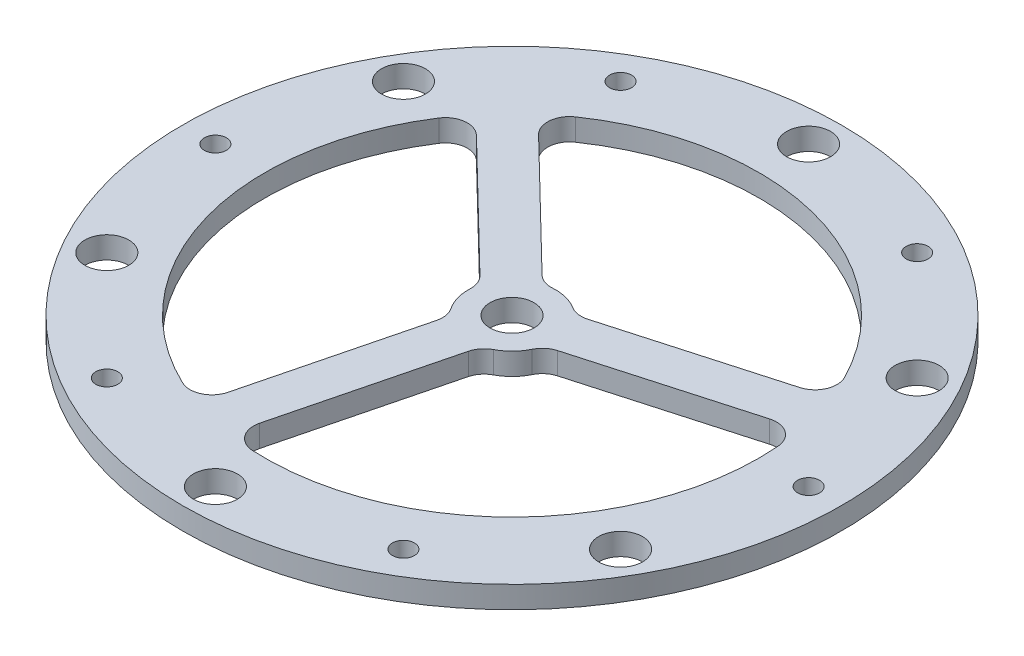
from build123d import *

# Parameters (mm, degrees)
SKETCH1_R                = 30
SKETCH1_R_2              = 2
BOSS_EXTRUDE1_DEPTH      = 2
SKETCH3_R                = 1
CUT_EXTRUDE1_DEPTH       = 3
SKETCH4_R                = 2
CUT_EXTRUDE2_DEPTH       = 10
FILLET1_R                = 2
CIRPATTERN1_COUNT        = 3
FILLET1_OF_CIRPATTERN1_R = 2


with BuildPart() as part:
    # Sketch1 → Boss-Extrude1 (new body)
    with BuildSketch(Plane(origin=(0, 0, 0), x_dir=(1, 0, 0), z_dir=(0, 1, 0))):
        with Locations(Location((0, 0, 0), (0, 0, 270))):
            Circle(SKETCH1_R)
        with Locations(Location((0, 27, 0), (0, 0, 270))):
            Circle(SKETCH1_R_2, mode=Mode.SUBTRACT)
        with Locations(Location((23.382685902, 13.5, 0), (0, 0, 270))):
            Circle(SKETCH1_R_2, mode=Mode.SUBTRACT)
        with Locations(Location((23.382685902, -13.5, 0), (0, 0, 270))):
            Circle(SKETCH1_R_2, mode=Mode.SUBTRACT)
        with Locations(Location((0, -27, 0), (0, 0, 270))):
            Circle(SKETCH1_R_2, mode=Mode.SUBTRACT)
        with Locations(Location((-23.382685902, -13.5, 0), (0, 0, 270))):
            Circle(SKETCH1_R_2, mode=Mode.SUBTRACT)
        with Locations(Location((-23.382685902, 13.5, 0), (0, 0, 270))):
            Circle(SKETCH1_R_2, mode=Mode.SUBTRACT)
    extrude(amount=BOSS_EXTRUDE1_DEPTH)

    # Sketch3 → Cut-Extrude1 (cut)
    with BuildSketch(Plane(origin=(0, 2, 0), x_dir=(1, 0, 0), z_dir=(0, 1, 0))):
        with Locations(Location((-13.5, 23.382685902, 0), (0, 0, 270))):
            Circle(SKETCH3_R)
        with Locations(Location((13.5, 23.382685902, 0), (0, 0, 270))):
            Circle(SKETCH3_R)
        with Locations(Location((27, 0, 0), (0, 0, 270))):
            Circle(SKETCH3_R)
        with Locations(Location((13.5, -23.382685902, 0), (0, 0, 270))):
            Circle(SKETCH3_R)
        with Locations(Location((-13.5, -23.382685902, 0), (0, 0, 270))):
            Circle(SKETCH3_R)
        with Locations(Location((-27, 0, 0), (0, 0, 270))):
            Circle(SKETCH3_R)
    extrude(amount=-CUT_EXTRUDE1_DEPTH, mode=Mode.SUBTRACT)

    # Sketch4 → Cut-Extrude2 (cut)
    with BuildSketch(Plane(origin=(0, 2, 0), x_dir=(1, 0, 0), z_dir=(0, 1, 0))):
        with Locations(Location((0, 0, 0), (0, 0, 270))):
            Circle(SKETCH4_R)
        with BuildLine():
            Line((-1.09088921, 3.848371179), (-14.680142304, 17.051200014))
            ThreePointArc((-14.680142304, 17.051200014), (5.509393992, 21.815053927), (21.015954319, 8.036147338))
            Line((21.015954319, 8.036147338), (2.787342599, 2.868923358))
            ThreePointArc((2.787342599, 2.868923358), (0.979447821, 3.878231809), (-1.09088921, 3.848371179))
        make_face()
    cut_extrude2 = extrude(amount=-CUT_EXTRUDE2_DEPTH, mode=Mode.SUBTRACT)

    # Fillet1
    fillet1_edges = [part.edges().sort_by_distance(p)[0] for p in [
        (2.787342599, 1, -2.868923358),
        (-1.09088921, 1, -3.848371179),
        (-14.680142304, 1, -17.051200014),
        (21.015954319, 1, -8.036147338),
    ]]
    fillet(fillet1_edges, radius=FILLET1_R)

    # CirPattern1: Cut-Extrude2 ×3 about axis
    cirpattern1_axis = Axis((0, 0, 0), (0, 1, 0))
    for i in range(1, CIRPATTERN1_COUNT):
        add(cut_extrude2.rotate(cirpattern1_axis, i * 360 / CIRPATTERN1_COUNT), mode=Mode.SUBTRACT)

    # Fillet1 of CirPattern1
    fillet1_of_cirpattern1_edges = [part.edges().sort_by_distance(p)[0] for p in [
        (-3.878231809, 1, -0.979447821),
        (-2.787342599, 1, 2.868923358),
        (-7.426701225, 1, 21.238976174),
        (-17.467484903, 1, -14.182276656),
        (1.09088921, 1, 3.848371179),
        (3.878231809, 1, 0.979447821),
        (22.10684353, 1, -4.187776159),
        (-3.548469416, 1, 22.218423995),
    ]]
    fillet(fillet1_of_cirpattern1_edges, radius=FILLET1_OF_CIRPATTERN1_R)


solid = part.part
